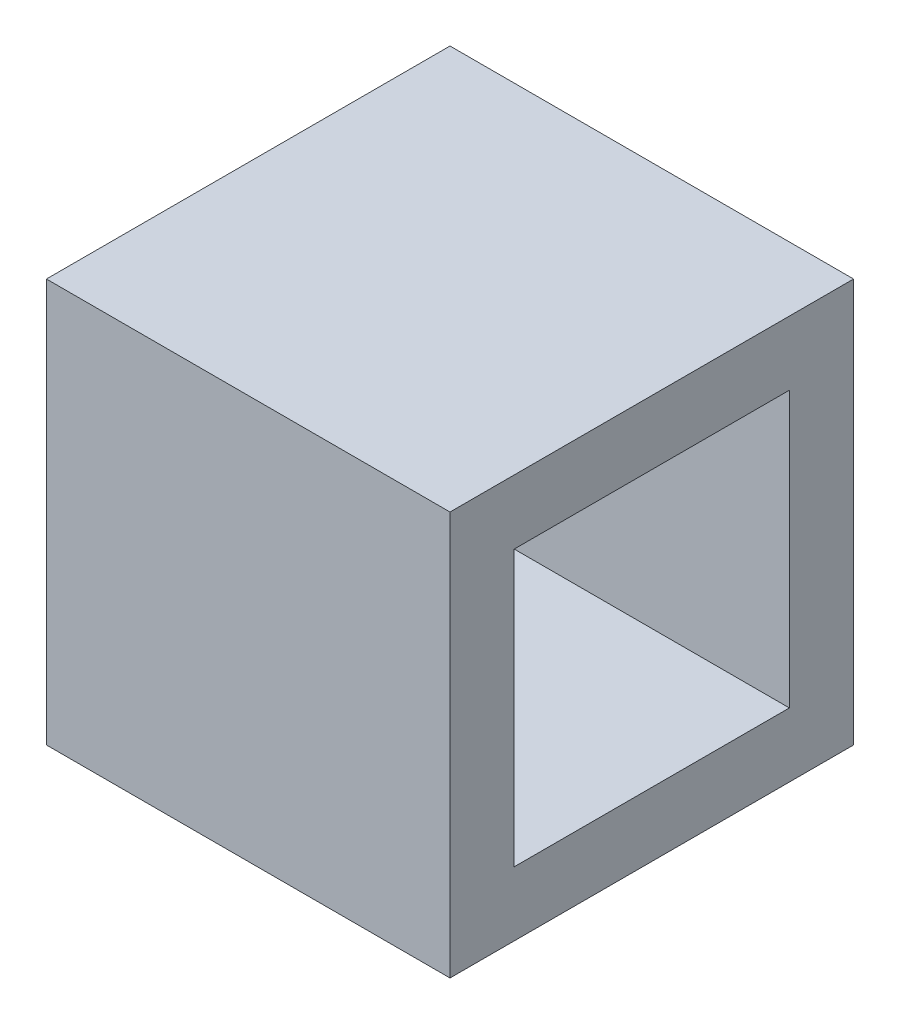
from build123d import *

# Parameters (mm, degrees)
SKETCH1_W           = 22
SKETCH1_H           = 22
BOSS_EXTRUDE1_DEPTH = 22
SKETCH2_W           = 15
SKETCH2_H           = 15
CUT_EXTRUDE1_DEPTH  = 18.5


with BuildPart() as part:
    # Sketch1 → Boss-Extrude1 (new body)
    with BuildSketch(Plane.XY):
        with Locations((35.558892609, -9.533232131)):
            Rectangle(SKETCH1_W, SKETCH1_H)
    extrude(amount=BOSS_EXTRUDE1_DEPTH)

    # Sketch2 → Cut-Extrude1 (cut)
    with BuildSketch(Plane(origin=(46.558892609, 0, 0), x_dir=(0, 0, -1), z_dir=(1, 0, 0))):
        with Locations((-11, -9.533232131)):
            Rectangle(SKETCH2_W, SKETCH2_H)
    extrude(amount=-CUT_EXTRUDE1_DEPTH, mode=Mode.SUBTRACT)


solid = part.part
